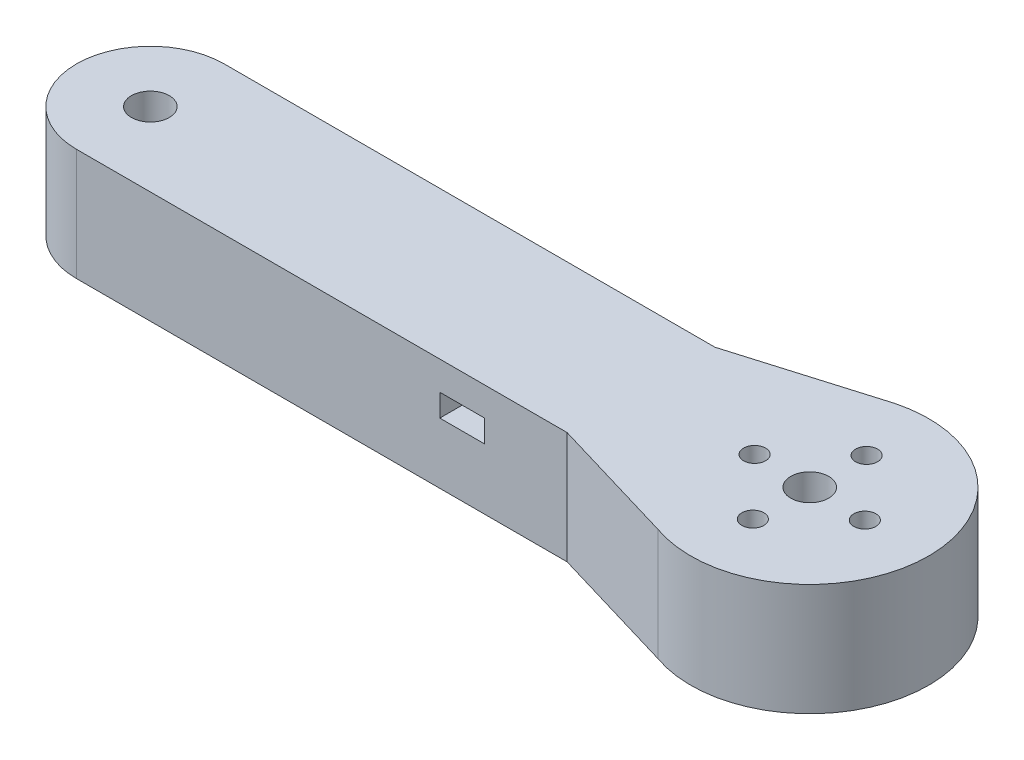
from build123d import *

# Parameters (mm, degrees)
SKETCH2_R               = 2.15
BOSS_EXTRUDE1_DEPTH     = 12.7
CUT_EXTRUDE1_DEPTH      = 86.777857097
CUT_EXTRUDE1_DEPTH_BACK = 86.777857097
SKETCH3_W               = 5.08
SKETCH3_H               = 2.54
BOSS_EXTRUDE2_DEPTH     = 12.7
SKETCH5_R               = 9.75
CUT_EXTRUDE2_DEPTH      = 5.5
CUT_EXTRUDE3_DEPTH      = 90.593664183
CUT_EXTRUDE3_DEPTH_BACK = 90.593664183
SKETCH6_R               = 1.25


with BuildPart() as part:
    # Sketch2 → Boss-Extrude1 (new body)
    with BuildSketch(Plane(origin=(0, 0, 0), x_dir=(1, 0, 0), z_dir=(0, 1, 0))):
        with BuildLine():
            Line((0, 8.382), (74.7776, 8.382))
            ThreePointArc((74.7776, 8.382), (83.1596, 0), (74.7776, -8.382))
            Line((74.7776, -8.382), (0, -8.382))
            ThreePointArc((0, -8.382), (-8.382, 0), (0, 8.382))
        make_face()
        with Locations(Location((0, 0, 0), (0, 0, 270))):
            Circle(SKETCH2_R, mode=Mode.SUBTRACT)
        with Locations(Location((74.7776, 0, 0), (0, 0, 270))):
            Circle(SKETCH2_R, mode=Mode.SUBTRACT)
    extrude(amount=-BOSS_EXTRUDE1_DEPTH)

    # Sketch3 → Cut-Extrude1 (cut, two sides: drawn at the far end of the back side and taken through both)
    with BuildSketch(Plane(origin=(0, 0, -8.382), x_dir=(-1, 0, 0), z_dir=(0, 0, -1)).offset(-CUT_EXTRUDE1_DEPTH_BACK)):
        with Locations((-43.750123937, -4.528631303)):
            Rectangle(SKETCH3_W, SKETCH3_H)
    extrude(amount=CUT_EXTRUDE1_DEPTH + CUT_EXTRUDE1_DEPTH_BACK, mode=Mode.SUBTRACT)

    # Sketch4 → Boss-Extrude2 (add)
    with BuildSketch(Plane(origin=(0, 0, 0), x_dir=(1, 0, 0), z_dir=(0, 1, 0))):
        with BuildLine():
            Line((71.377269841, 13.064752382), (70.480233935, 12.79775937))
            ThreePointArc((70.480233935, 12.79775937), (67.016909963, 11.04634284), (64.194969136, 8.382))
            Line((64.194969136, 8.382), (74.7776, 8.382))
            ThreePointArc((74.7776, 8.382), (83.1596, 0), (74.7776, -8.382))
            Line((74.7776, -8.382), (64.194969136, -8.382))
            ThreePointArc((64.194969136, -8.382), (66.930768284, -10.985318931), (70.280616628, -12.728988198))
            ThreePointArc((70.280616628, -12.728988198), (82.573134763, -11.021780154), (88.2776, 0))
            ThreePointArc((88.2776, 0), (83.034280412, 10.680694199), (71.377269841, 13.064752382))
        make_face()
        with BuildLine():
            Line((70.480233935, 12.79775937), (55.644284932, 8.382))
            Line((55.644284932, 8.382), (64.194969136, 8.382))
            ThreePointArc((64.194969136, 8.382), (67.016909963, 11.04634284), (70.480233935, 12.79775937))
        make_face()
        with BuildLine():
            ThreePointArc((70.280616628, -12.728988198), (66.930768284, -10.985318931), (64.194969136, -8.382))
            Line((64.194969136, -8.382), (55.644284932, -8.382))
            Line((55.644284932, -8.382), (70.280616628, -12.728988198))
        make_face()
    extrude(amount=-BOSS_EXTRUDE2_DEPTH)

    # Sketch5 → Cut-Extrude2 (cut)
    with BuildSketch(Plane(origin=(0, -12.7, 0), x_dir=(-1, 0, 0), z_dir=(0, -1, 0))):
        with Locations(Location((-74.7776, 0, 0), (0, 0, 90))):
            Circle(SKETCH5_R)
    extrude(amount=-CUT_EXTRUDE2_DEPTH, mode=Mode.SUBTRACT)

    # Sketch6 → Cut-Extrude3 (cut, two sides: drawn at the far end of the back side and taken through both)
    with BuildSketch(Plane(origin=(0, -7.2, 0), x_dir=(-1, 0, 0), z_dir=(0, -1, 0)).offset(-CUT_EXTRUDE3_DEPTH_BACK)):
        with Locations(Location((-74.876863781, 6.35, 0), (0, 0, 90))):
            Circle(SKETCH6_R)
        with Locations(Location((-68.4276, 0.099263781, 0), (0, 0, 90))):
            Circle(SKETCH6_R)
        with Locations(Location((-74.678336219, -6.35, 0), (0, 0, 90))):
            Circle(SKETCH6_R)
        with Locations(Location((-81.1276, -0.099263781, 0), (0, 0, 90))):
            Circle(SKETCH6_R)
    extrude(amount=CUT_EXTRUDE3_DEPTH + CUT_EXTRUDE3_DEPTH_BACK, mode=Mode.SUBTRACT)


solid = part.part
